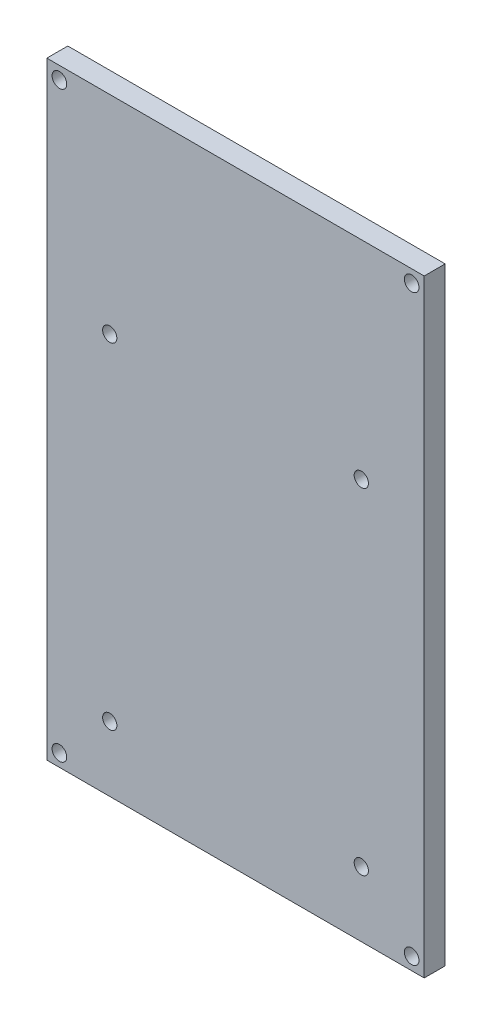
from build123d import *

# Parameters (mm, degrees)
SKETCH1_W           = 90
SKETCH1_H           = 145
BOSS_EXTRUDE1_DEPTH = 5
SKETCH2_R           = 1.75
CUT_EXTRUDE1_DEPTH  = 86.476604986
SKETCH3_R           = 1.7
CUT_EXTRUDE2_DEPTH  = 86.476604986


with BuildPart() as part:
    # Sketch1 → Boss-Extrude1 (new body)
    with BuildSketch(Plane.XY):
        Rectangle(SKETCH1_W, SKETCH1_H)
    extrude(amount=BOSS_EXTRUDE1_DEPTH)

    # Sketch2 → Cut-Extrude1 (cut, through all)
    with BuildSketch(Plane(origin=(0, 0, 0), x_dir=(-1, 0, 0), z_dir=(0, 0, -1))):
        with Locations((-42, 69.5)):
            Circle(SKETCH2_R)
        with Locations(Location((-42, -69.5, 0), (0, 0, 180))):
            Circle(SKETCH2_R)
        with Locations(Location((42, 69.5, 0), (0, 0, 180))):
            Circle(SKETCH2_R)
        with Locations((42, -69.5)):
            Circle(SKETCH2_R)
    extrude(amount=-CUT_EXTRUDE1_DEPTH, mode=Mode.SUBTRACT)

    # Sketch3 → Cut-Extrude2 (cut, through all)
    with BuildSketch(Plane(origin=(0, 0, 0), x_dir=(-1, 0, 0), z_dir=(0, 0, -1))):
        with Locations((-30, 23)):
            Circle(SKETCH3_R)
        with Locations(Location((30, 23, 0), (0, 0, 180))):
            Circle(SKETCH3_R)
        with Locations((30, -57)):
            Circle(SKETCH3_R)
        with Locations(Location((-30, -57, 0), (0, 0, 180))):
            Circle(SKETCH3_R)
    extrude(amount=-CUT_EXTRUDE2_DEPTH, mode=Mode.SUBTRACT)


solid = part.part
